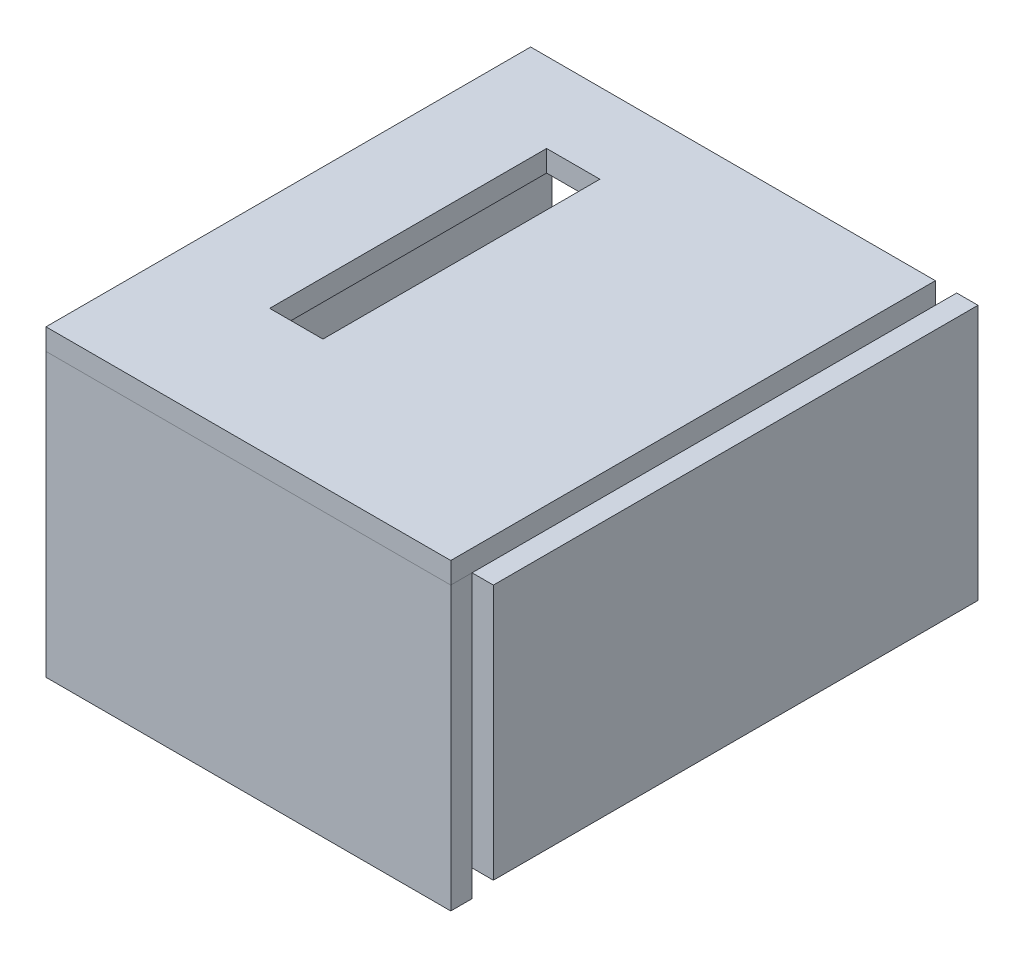
from build123d import *

# Parameters (mm, degrees)
SKETCH1_W           = 241.3
SKETCH1_H           = 288.925
SKETCH1_W_2         = 31.75
SKETCH1_H_2         = 165.1
BOSS_EXTRUDE1_DEPTH = 12.7
SKETCH2_W           = 241.3
SKETCH2_H           = 168.275
BOSS_EXTRUDE3_DEPTH = 12.7
SKETCH3_W           = 288.925
SKETCH3_H           = 152.4
BOSS_EXTRUDE4_DEPTH = 12.7
SKETCH5_W           = 288.925
SKETCH5_H           = 152.4
BOSS_EXTRUDE6_DEPTH = 12.7


with BuildPart() as part:
    # Sketch1 → Boss-Extrude1 (new body)
    with BuildSketch(Plane(origin=(0, 0, 0), x_dir=(1, 0, 0), z_dir=(0, 1, 0))):
        Rectangle(SKETCH1_W, SKETCH1_H)
        with Locations((-47.625, 14.2875)):
            Rectangle(SKETCH1_W_2, SKETCH1_H_2, mode=Mode.SUBTRACT)
    extrude(amount=BOSS_EXTRUDE1_DEPTH)


with BuildPart() as body_2:
    # Sketch2 → Boss-Extrude3 (new body)
    with BuildSketch(Plane.XY.offset(144.4625)):
        with Locations((0, -84.1375)):
            Rectangle(SKETCH2_W, SKETCH2_H)
    extrude(amount=-BOSS_EXTRUDE3_DEPTH)


with BuildPart() as body_3:
    # Sketch3 → Boss-Extrude4 (new body)
    with BuildSketch(Plane(origin=(120.65, 0, 0), x_dir=(0, 0, -1), z_dir=(1, 0, 0))):
        with Locations((12.7, -76.2)):
            Rectangle(SKETCH3_W, SKETCH3_H)
    extrude(amount=BOSS_EXTRUDE4_DEPTH)


with BuildPart() as body_4:
    # Sketch5 → Boss-Extrude6 (new body)
    with BuildSketch(Plane.ZY.offset(120.65)):
        with Locations((-12.7, -76.2)):
            Rectangle(SKETCH5_W, SKETCH5_H)
    extrude(amount=BOSS_EXTRUDE6_DEPTH)


solid = Compound([part.part, body_2.part, body_3.part, body_4.part])
